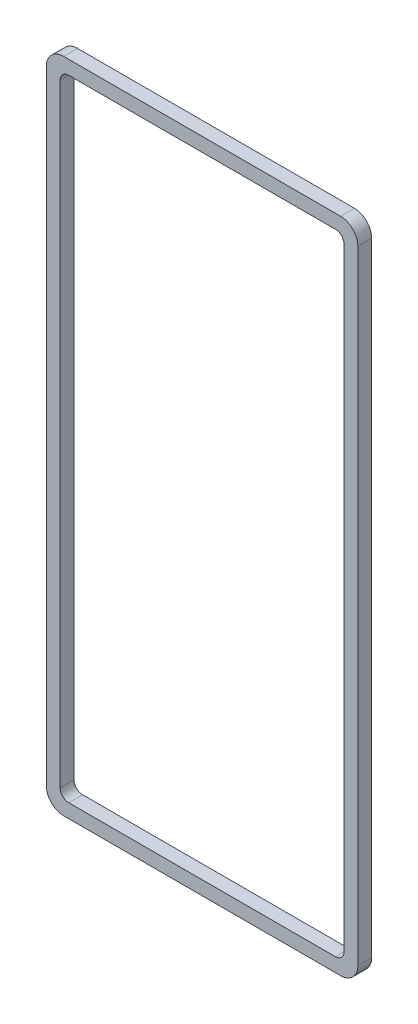
from build123d import *

# Parameters (mm, degrees)
ESQUISSE1_W        = 900
ESQUISSE1_H        = 1900
ESQUISSE1_W_2      = 820
ESQUISSE1_H_2      = 1820
BOSS_EXTRU_1_DEPTH = 40
CONG_1_R           = 50
CONG_2_R           = 25


with BuildPart() as part:
    # Esquisse1 → Boss.-Extru.1 (new body)
    with BuildSketch(Plane.XY):
        with Locations((450, 950)):
            Rectangle(ESQUISSE1_W, ESQUISSE1_H)
        with Locations((450, 950)):
            Rectangle(ESQUISSE1_W_2, ESQUISSE1_H_2, mode=Mode.SUBTRACT)
    extrude(amount=BOSS_EXTRU_1_DEPTH)

    # Congé1
    cong_1_edges = [part.edges().sort_by_distance(p)[0] for p in [
        (0, 1900, 20),
        (900, 1900, 20),
        (900, 0, 20),
        (0, 0, 20),
    ]]
    fillet(cong_1_edges, radius=CONG_1_R)

    # Congé2
    cong_2_edges = [part.edges().sort_by_distance(p)[0] for p in [
        (40, 1860, 20),
        (40, 40, 20),
        (860, 40, 20),
        (860, 1860, 20),
    ]]
    fillet(cong_2_edges, radius=CONG_2_R)


solid = part.part
